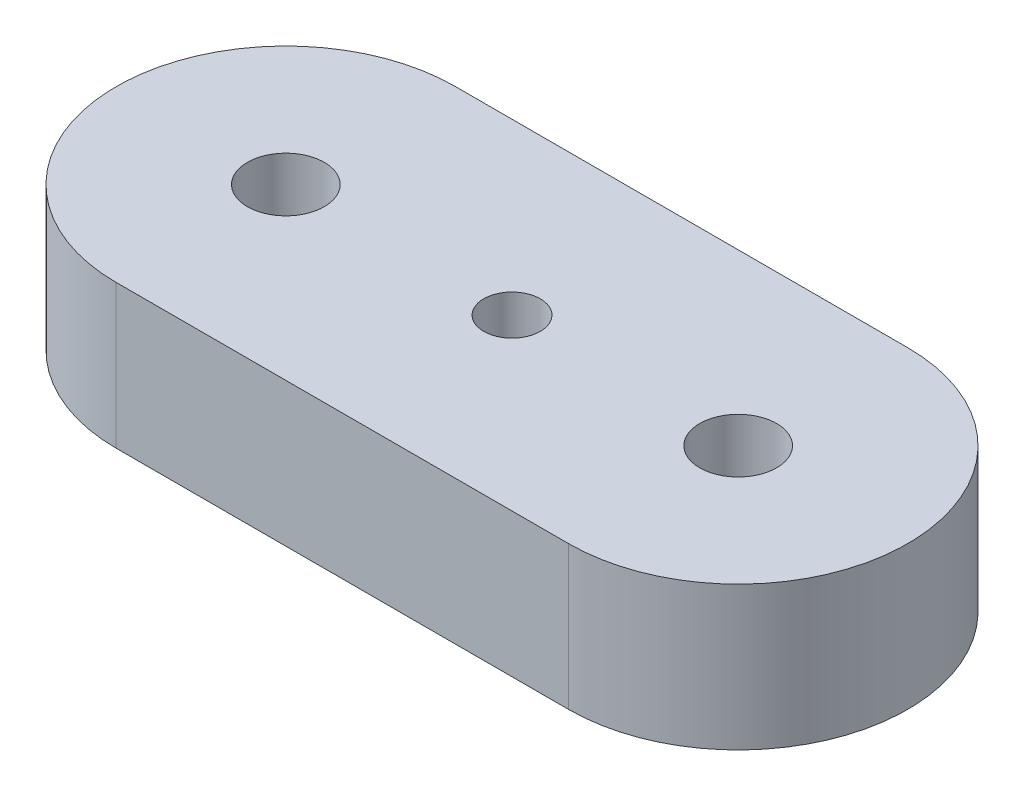
from build123d import *

# Parameters (mm, degrees)
BOSS_EXTRUDE1_DEPTH         = 6.35
M3_CLEARANCE_HOLE1_D        = 3.4
TAP_DRILL_FOR_M3X0_5_TAP1_D = 2.5


with BuildPart() as part:
    # Sketch1 → Boss-Extrude1 (new body)
    with BuildSketch(Plane(origin=(0, 0, 0), x_dir=(1, 0, 0), z_dir=(0, 1, 0))):
        with BuildLine():
            Line((0, 0), (20, 0))
            ThreePointArc((20, 0), (27.5, 7.5), (20, 15))
            Line((20, 15), (0, 15))
            ThreePointArc((0, 15), (-7.5, 7.5), (0, 0))
        make_face()
    extrude(amount=BOSS_EXTRUDE1_DEPTH)

    # M3 Clearance Hole1 (through all)
    with Locations(Plane(origin=(0, 6.35, -7.5), x_dir=(0, 0, 1), z_dir=(0, 1, 0))):
        with Locations((0, 0), (0, 20)):
            Hole(M3_CLEARANCE_HOLE1_D / 2)

    # Tap Drill for M3x0.5 Tap1 (through all)
    with Locations(Plane(origin=(10, 6.35, -7.5), x_dir=(0, 0, 1), z_dir=(0, 1, 0))):
        with Locations((0, 0)):
            Hole(TAP_DRILL_FOR_M3X0_5_TAP1_D / 2)


solid = part.part
